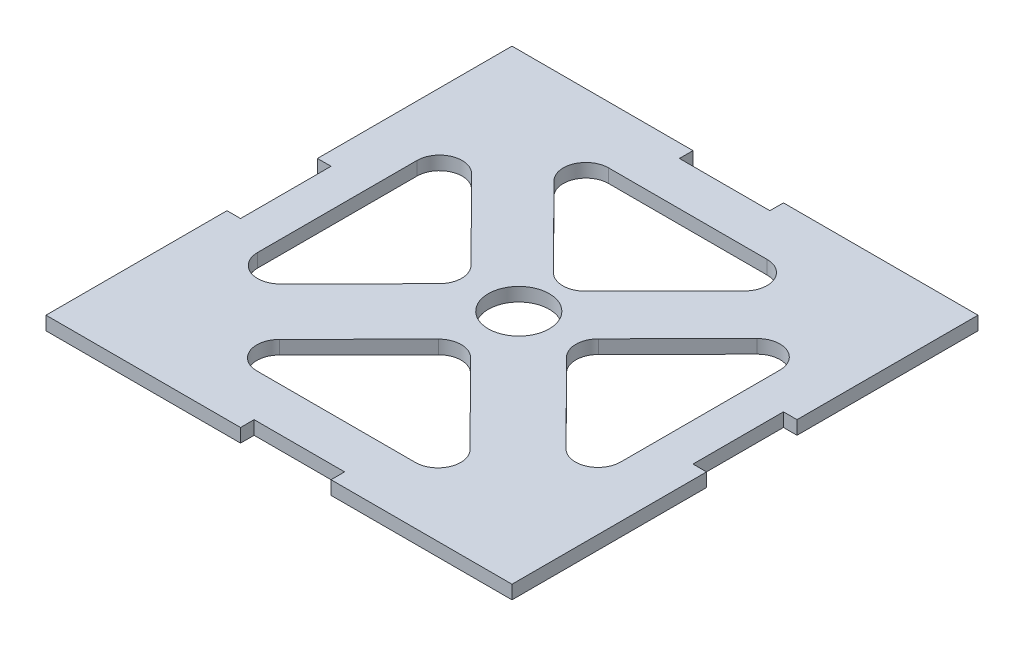
from build123d import *

# Parameters (mm, degrees)
SKETCH1_R           = 6.736700536
BOSS_EXTRUDE1_DEPTH = 3
FILLET1_R           = 5
FILLET2_R           = 5


with BuildPart() as part:
    # Sketch1 → Boss-Extrude1 (new body)
    with BuildSketch(Plane(origin=(0, 0, 0), x_dir=(1, 0, 0), z_dir=(0, 1, 0))):
        Polygon((-51.5, -13), (-51.5, -53), (-8.5, -53), (-8.5, -50), (11.5, -50), (11.5, -53), (51.5, -53), (51.5, -10), (48.5, -10), (48.5, 10), (51.5, 10), (51.5, 50), (8.5, 50), (8.5, 47), (-11.5, 47), (-11.5, 50), (-51.5, 50), (-51.5, 7), (-48.5, 7), (-48.5, -13), align=None)
        Polygon((-40.119028072, -29.730929333), (-40.119028072, 29.730929333), (-10.573569788, 0), align=None, mode=Mode.SUBTRACT)
        Polygon((-29.545458284, 37.370874503), (29.545458284, 37.370874503), (4.043573282, 11.708901907), (-0.025303783, 7.665407798), align=None, mode=Mode.SUBTRACT)
        Polygon((40.119028072, 29.730929333), (40.119028072, -29.730929333), (10.573569788, 0), align=None, mode=Mode.SUBTRACT)
        Polygon((29.545458284, -40.370874503), (-29.545458284, -40.370874503), (0, -10.63994517), align=None, mode=Mode.SUBTRACT)
        with Locations(Location((0, 0, 0), (0, 0, 270))):
            Circle(SKETCH1_R, mode=Mode.SUBTRACT)
    extrude(amount=BOSS_EXTRUDE1_DEPTH)

    # Fillet1
    fillet1_edges = [part.edges().sort_by_distance(p)[0] for p in [
        (29.545458284, 1.5, 40.370874503),
        (-29.545458284, 1.5, 40.370874503),
        (-40.119028072, 1.5, -29.730929333),
        (-40.119028072, 1.5, 29.730929333),
        (29.545458284, 1.5, -37.370874503),
        (-29.545458284, 1.5, -37.370874503),
        (40.119028072, 1.5, 29.730929333),
        (40.119028072, 1.5, -29.730929333),
    ]]
    fillet(fillet1_edges, radius=FILLET1_R)

    # Fillet2
    fillet2_edges = [part.edges().sort_by_distance(p)[0] for p in [
        (0, 1.5, 10.63994517),
        (-10.573569788, 1.5, 0),
        (-0.025303783, 1.5, -7.665407798),
        (10.573569788, 1.5, 0),
    ]]
    fillet(fillet2_edges, radius=FILLET2_R)


solid = part.part
